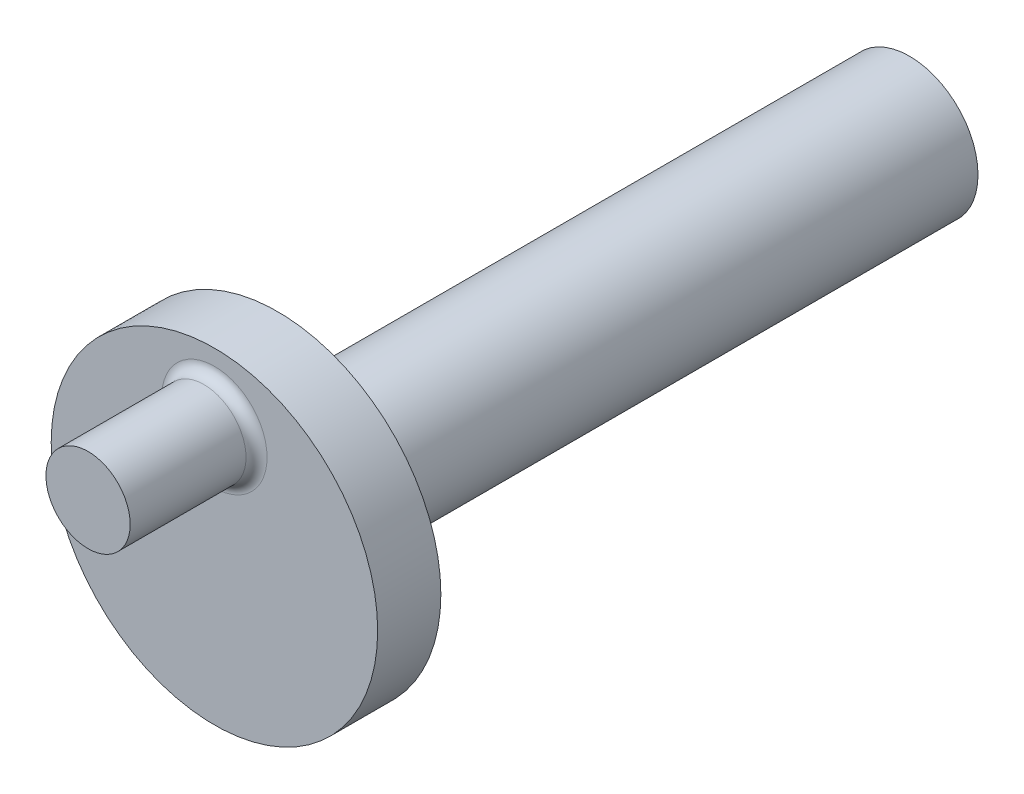
from build123d import *

# Parameters (mm, degrees)
SKETCH1_R           = 15.5
BOSS_EXTRUDE2_DEPTH = 3
BOSS_EXTRUDE3_START = 3
SKETCH1_6_R         = 4
BOSS_EXTRUDE3_DEPTH = 12
SKETCH2_R           = 6.5
BOSS_EXTRUDE4_DEPTH = 60
FILLET1_R           = 1


with BuildPart() as part:
    # Sketch1 → Boss-Extrude2 (new, symmetric)
    with BuildSketch(Plane.XY):
        Circle(SKETCH1_R)
    extrude(amount=BOSS_EXTRUDE2_DEPTH, both=True)

    # Sketch1<6> → Boss-Extrude3 (add)
    with BuildSketch(Plane.XY.offset(BOSS_EXTRUDE3_START)):
        with Locations((0, 9)):
            Circle(SKETCH1_6_R)
    extrude(amount=BOSS_EXTRUDE3_DEPTH)

    # Sketch2 → Boss-Extrude4 (add)
    with BuildSketch(Plane(origin=(0, 0, -3), x_dir=(-1, 0, 0), z_dir=(0, 0, -1))):
        Circle(SKETCH2_R)
    extrude(amount=BOSS_EXTRUDE4_DEPTH)

    # Fillet1
    fillet1_edges = [part.edges().sort_by_distance(p)[0] for p in [
        (-4, 9, 3),
        (6.5, 0, -3),
    ]]
    fillet(fillet1_edges, radius=FILLET1_R)


solid = part.part
